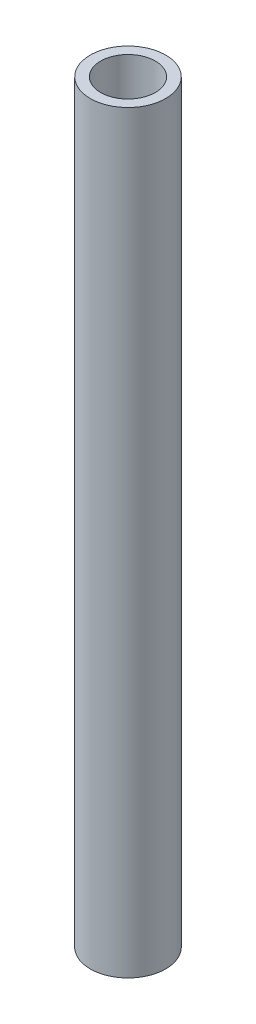
from build123d import *

# Parameters (mm, degrees)
SKETCH1_R           = 4
BOSS_EXTRUDE1_DEPTH = 80
SKETCH2_R           = 2.899419097
CUT_EXTRUDE1_DEPTH  = 10


with BuildPart() as part:
    # Sketch1 → Boss-Extrude1 (new body)
    with BuildSketch(Plane(origin=(0, 0, 0), x_dir=(1, 0, 0), z_dir=(0, 1, 0))):
        with Locations(Location((0, 0, 0), (0, 0, 270))):
            Circle(SKETCH1_R)
    extrude(amount=BOSS_EXTRUDE1_DEPTH)

    # Sketch2 → Cut-Extrude1 (cut)
    with BuildSketch(Plane(origin=(0, 80, 0), x_dir=(1, 0, 0), z_dir=(0, 1, 0))):
        with Locations(Location((0, 0, 0), (0, 0, 270))):
            Circle(SKETCH2_R)
    extrude(amount=-CUT_EXTRUDE1_DEPTH, mode=Mode.SUBTRACT)


solid = part.part
